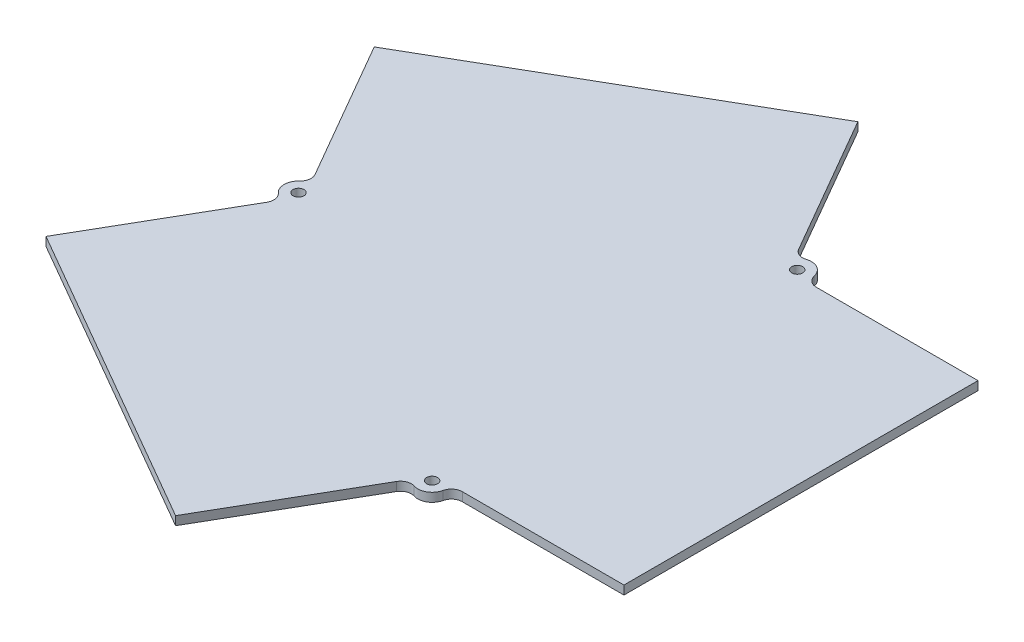
from build123d import *

# Parameters (mm, degrees)
SKETCH1_R           = 1.25
BOSS_EXTRUDE1_DEPTH = 2
FILLET1_R           = 2.5


with BuildPart() as part:
    # Sketch1 → Boss-Extrude1 (new body)
    with BuildSketch(Plane(origin=(0, 0, 0), x_dir=(1, 0, 0), z_dir=(0, 1, 0))):
        with BuildLine():
            Line((-103.965757813, 67.162425071), (-33.817700106, 107.662425071))
            Line((-33.817700106, 107.662425071), (-14.010882201, 73.356010123))
            ThreePointArc((-14.010882201, 73.356010123), (-9.775048525, 74.210673935), (-8.39729226, 70.115002459))
            Line((-8.39729226, 70.115002459), (31.216343551, 70.115002459))
            Line((31.216343551, 70.115002459), (31.216343551, -10.884997541))
            Line((31.216343551, -10.884997541), (-8.39729226, -10.884997541))
            ThreePointArc((-8.39729226, -10.884997541), (-9.775048525, -14.980669016), (-14.010882201, -14.126005204))
            Line((-14.010882201, -14.126005204), (-33.817700106, -48.432420153))
            Line((-33.817700106, -48.432420153), (-103.965757813, -7.932420153))
            Line((-103.965757813, -7.932420153), (-84.158939907, 26.373994796))
            ThreePointArc((-84.158939907, 26.373994796), (-87.017017318, 29.615002459), (-84.158939907, 32.856010123))
            Line((-84.158939907, 32.856010123), (-103.965757813, 67.162425071))
        make_face()
        with Locations(Location((-83.75035682, 29.615002459, 0), (0, 0, 270))):
            Circle(SKETCH1_R, mode=Mode.SUBTRACT)
        with Locations(Location((-11.408378774, 71.381662958, 0), (0, 0, 270))):
            Circle(SKETCH1_R, mode=Mode.SUBTRACT)
        with Locations(Location((-11.408378774, -12.151658039, 0), (0, 0, 270))):
            Circle(SKETCH1_R, mode=Mode.SUBTRACT)
    extrude(amount=BOSS_EXTRUDE1_DEPTH)

    # Fillet1
    fillet1_edges = [part.edges().sort_by_distance(p)[0] for p in [
        (-14.010882201, 1, -73.356010123),
        (-8.39729226, 1, -70.115002459),
        (-8.39729226, 1, 10.884997541),
        (-14.010882201, 1, 14.126005204),
        (-84.158939907, 1, -26.373994796),
        (-84.158939907, 1, -32.856010123),
    ]]
    fillet(fillet1_edges, radius=FILLET1_R)


solid = part.part
